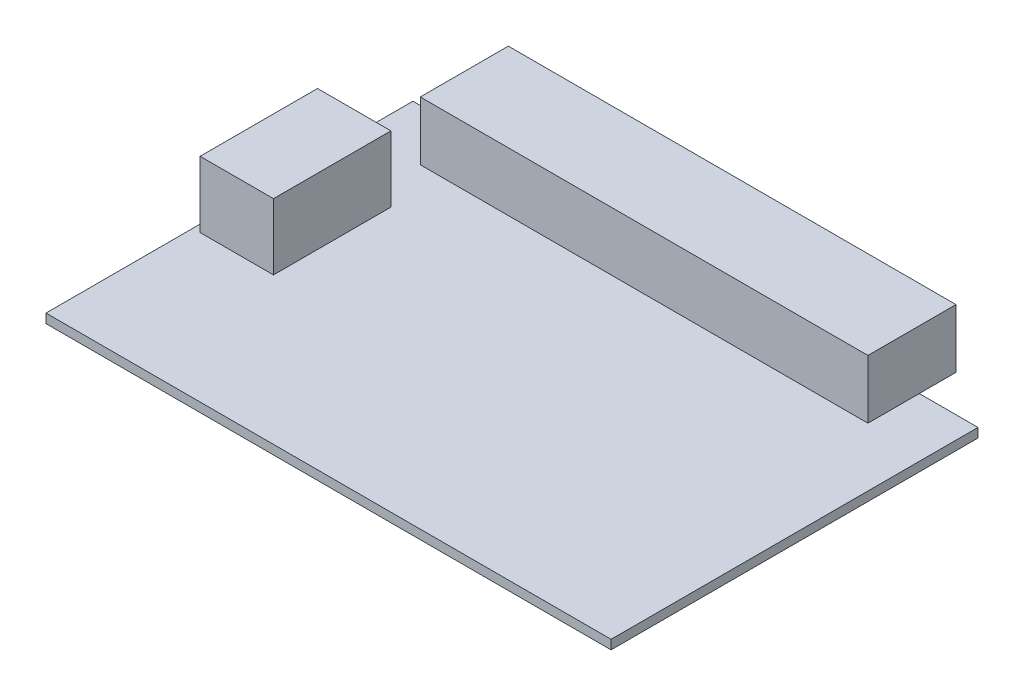
from build123d import *

# Parameters (mm, degrees)
SKETCH1_W           = 77
SKETCH1_H           = 50
BOSS_EXTRUDE1_DEPTH = 1.25
SKETCH2_W           = 10
SKETCH2_H           = 16
BOSS_EXTRUDE2_DEPTH = 9
SKETCH3_W           = 61
SKETCH3_H           = 12
BOSS_EXTRUDE3_DEPTH = 8


with BuildPart() as part:
    # Sketch1 → Boss-Extrude1 (new body)
    with BuildSketch(Plane(origin=(0, 0, 0), x_dir=(1, 0, 0), z_dir=(0, 1, 0))):
        Rectangle(SKETCH1_W, SKETCH1_H)
    extrude(amount=BOSS_EXTRUDE1_DEPTH)

    # Sketch2 → Boss-Extrude2 (add)
    with BuildSketch(Plane(origin=(0, 1.25, 0), x_dir=(1, 0, 0), z_dir=(0, 1, 0))):
        with Locations((-32.5, 3)):
            Rectangle(SKETCH2_W, SKETCH2_H)
    extrude(amount=BOSS_EXTRUDE2_DEPTH)

    # Sketch3 → Boss-Extrude3 (add)
    with BuildSketch(Plane(origin=(0, 1.25, 0), x_dir=(1, 0, 0), z_dir=(0, 1, 0))):
        with Locations((0, 24)):
            Rectangle(SKETCH3_W, SKETCH3_H)
    extrude(amount=BOSS_EXTRUDE3_DEPTH)


solid = part.part
